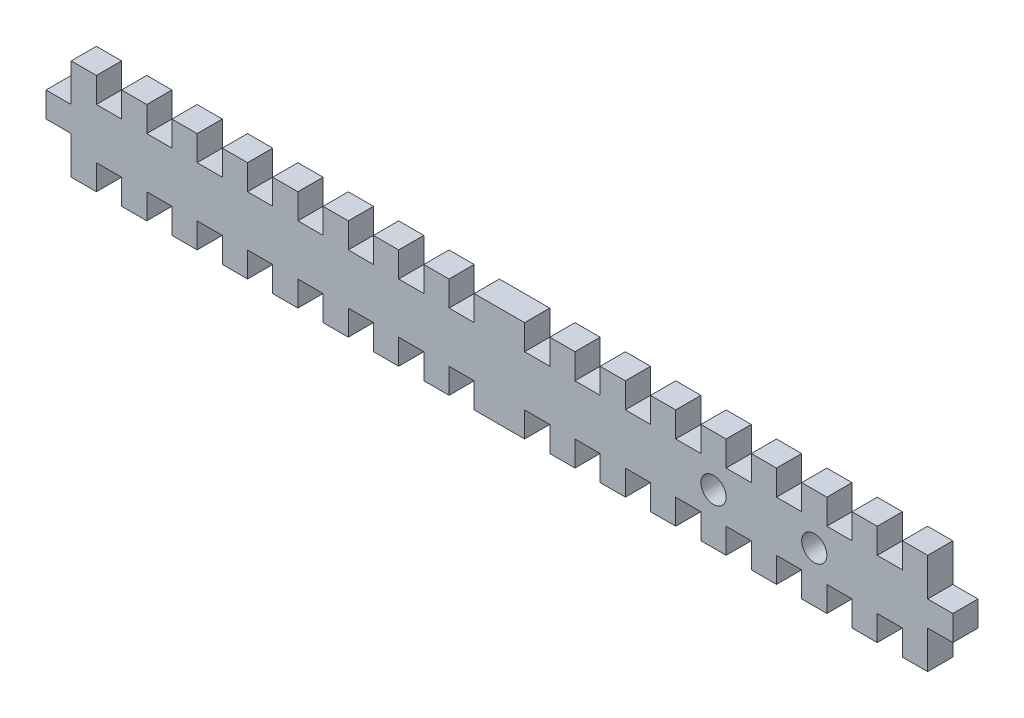
from build123d import *

# Parameters (mm, degrees)
SKETCH2_R           = 3.175
BOSS_EXTRUDE1_DEPTH = 6.35


with BuildPart() as part:
    # Sketch2 → Boss-Extrude1 (new body)
    with BuildSketch(Plane.XY):
        Polygon((-101.6, 12.7), (-107.95, 12.7), (-107.95, 3.175), (-114.3, 3.175), (-114.3, -3.175), (-107.95, -3.175), (-107.95, -12.7), (-101.6, -12.7), (-101.6, -6.35), (-95.25, -6.35), (-95.25, -12.7), (-88.9, -12.7), (-88.9, -6.35), (-82.55, -6.35), (-82.55, -12.7), (-76.2, -12.7), (-76.2, -6.35), (-69.85, -6.35), (-69.85, -12.7), (-63.5, -12.7), (-63.5, -6.35), (-57.15, -6.35), (-57.15, -12.7), (-50.8, -12.7), (-50.8, -6.35), (-44.45, -6.35), (-44.45, -12.7), (-38.1, -12.7), (-38.1, -6.35), (-31.75, -6.35), (-31.75, -12.7), (-25.4, -12.7), (-25.4, -6.35), (-19.05, -6.35), (-19.05, -12.7), (-12.7, -12.7), (-12.7, -6.35), (-6.35, -6.35), (-6.35, -12.7), (6.35, -12.7), (6.35, -6.35), (12.7, -6.35), (12.7, -12.7), (19.05, -12.7), (19.05, -6.35), (25.4, -6.35), (25.4, -12.7), (31.75, -12.7), (31.75, -6.35), (38.1, -6.35), (38.1, -12.7), (44.45, -12.7), (44.45, -6.35), (50.8, -6.35), (50.8, -12.7), (57.15, -12.7), (57.15, -6.35), (63.5, -6.35), (63.5, -12.7), (69.85, -12.7), (69.85, -6.35), (76.2, -6.35), (76.2, -12.7), (82.55, -12.7), (82.55, -6.35), (88.9, -6.35), (88.9, -12.7), (95.25, -12.7), (95.25, -6.35), (101.6, -6.35), (101.6, -12.7), (107.95, -12.7), (107.95, -3.175), (114.3, -3.175), (114.3, 3.175), (107.95, 3.175), (107.95, 12.7), (101.6, 12.7), (101.6, 6.35), (95.25, 6.35), (95.25, 12.7), (88.9, 12.7), (88.9, 6.35), (82.55, 6.35), (82.55, 12.7), (76.2, 12.7), (76.2, 6.35), (69.85, 6.35), (69.85, 12.7), (63.5, 12.7), (63.5, 6.35), (57.15, 6.35), (57.15, 12.7), (50.8, 12.7), (50.8, 6.35), (44.45, 6.35), (44.45, 12.7), (38.1, 12.7), (38.1, 6.35), (31.75, 6.35), (31.75, 12.7), (25.4, 12.7), (25.4, 6.35), (19.05, 6.35), (19.05, 12.7), (12.7, 12.7), (12.7, 6.35), (6.35, 6.35), (6.35, 12.7), (-6.35, 12.7), (-6.35, 6.35), (-12.7, 6.35), (-12.7, 12.7), (-19.05, 12.7), (-19.05, 6.35), (-25.4, 6.35), (-25.4, 12.7), (-31.75, 12.7), (-31.75, 6.35), (-38.1, 6.35), (-38.1, 12.7), (-44.45, 12.7), (-44.45, 6.35), (-50.8, 6.35), (-50.8, 12.7), (-57.15, 12.7), (-57.15, 6.35), (-63.5, 6.35), (-63.5, 12.7), (-69.85, 12.7), (-69.85, 6.35), (-76.2, 6.35), (-76.2, 12.7), (-82.55, 12.7), (-82.55, 6.35), (-88.9, 6.35), (-88.9, 12.7), (-95.25, 12.7), (-95.25, 6.35), (-101.6, 6.35), align=None)
        with Locations((53.975, 0)):
            Circle(SKETCH2_R, mode=Mode.SUBTRACT)
        with Locations((79.375, 0)):
            Circle(SKETCH2_R, mode=Mode.SUBTRACT)
    extrude(amount=BOSS_EXTRUDE1_DEPTH)


solid = part.part
